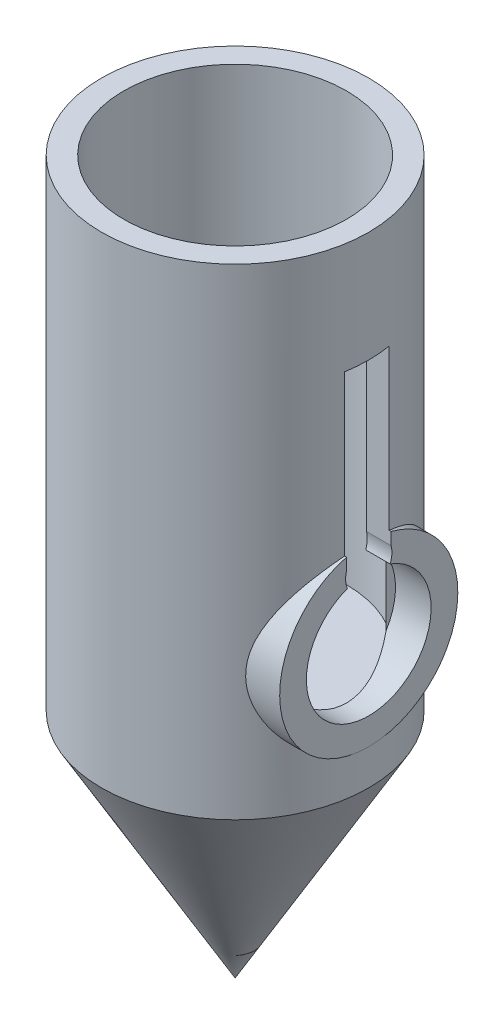
from build123d import *

# Parameters (mm, degrees)
BOSS_EXTRUDE1_REACH     = 57.084
SENSOR_R                = 6.35
SKETCH4_R               = 4.445
CUT_EXTRUDE1_DEPTH      = 2.54
CUT_EXTRUDE2_REACH      = 57.084
CUT_EXTRUDE2_END_RADIUS = 7.9375


with BuildPart() as part:
    # Sketch1 → mainBody (revolve)
    with BuildSketch(Plane(origin=(0, 0, 0), x_dir=(0, 0, -1), z_dir=(1, 0, 0)), mode=Mode.PRIVATE) as mainbody_sk:
        Polygon((-9.525, 0), (-7.9375, 0), (-7.9375, -30.492216058), (0, -30.492216058), (0, -50.8), (-9.525, -34.302216058), align=None)
    revolve(mainbody_sk.sketch.rotate(Axis((0, 0, 0), (0, 1, 0)), 180), axis=Axis((0, 0, 0), (0, 1, 0)))

    # sensor → Boss-Extrude1 (add, up to next)
    with BuildSketch(Plane(origin=(9.525, 0, 0), x_dir=(0, 0, -1), z_dir=(1, 0, 0)), mode=Mode.PRIVATE) as boss_extrude1_sk1:
        with Locations((0, -25.412216058)):
            Circle(SENSOR_R)
    boss_extrude1_tool1 = extrude(boss_extrude1_sk1.sketch, amount=-BOSS_EXTRUDE1_REACH, mode=Mode.PRIVATE) - part.part
    add(boss_extrude1_tool1.solids().sort_by_distance((9.525, -25.412216, 0))[0])
    add(boss_extrude1_tool1.solids().sort_by_distance((9.525, -25.412216, 0))[1])

    # Sketch4 → Cut-Extrude1 (cut)
    with BuildSketch(Plane(origin=(9.525, 0, 0), x_dir=(0, 0, -1), z_dir=(1, 0, 0))):
        with Locations((0, -25.412216058)):
            Circle(SKETCH4_R)
    extrude(amount=-CUT_EXTRUDE1_DEPTH, mode=Mode.SUBTRACT)

    # Cut-Extrude2: up to this cylinder (the profile starts outside it)
    cut_extrude2_end = Plane(origin=(0, -14.917784, 0), z_dir=(0, -1, 0)) * Cylinder(CUT_EXTRUDE2_END_RADIUS, 131.043, mode=Mode.PRIVATE)
    # Sketch5 → Cut-Extrude2 (cut, up to the surface)
    with BuildSketch(Plane(origin=(9.525, 0, 0), x_dir=(0, 0, -1), z_dir=(1, 0, 0)), mode=Mode.PRIVATE) as cut_extrude2_sk1:
        with BuildLine():
            Line((-1.5875, -7.886216058), (1.5875, -7.886216058))
            Line((1.5875, -7.886216058), (1.5875, -20.132735353))
            ThreePointArc((1.5875, -20.132735353), (0, -22.237216058), (-1.5875, -20.132735353))
            Line((-1.5875, -20.132735353), (-1.5875, -7.886216058))
        make_face()
    cut_extrude2_tool1 = extrude(cut_extrude2_sk1.sketch, amount=-CUT_EXTRUDE2_REACH, mode=Mode.PRIVATE) - cut_extrude2_end
    add(cut_extrude2_tool1.solids().sort_by_distance((9.525, -14.917784, 0))[0], mode=Mode.SUBTRACT)


solid = part.part
